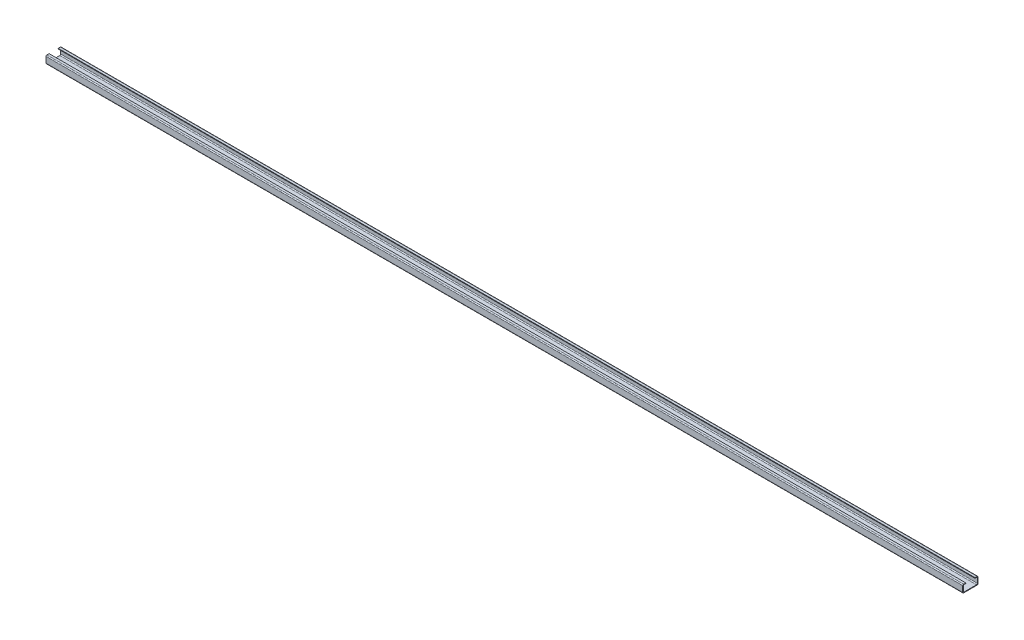
from build123d import *

# Parameters (mm, degrees)
RESSALTO_EXTRUS_O1_DEPTH = 6000
FILETE1_R                = 6


with BuildPart() as part:
    # Esboço1 → Ressalto-extrusão1 (new body)
    with BuildSketch(Plane(origin=(0, 0, 0), x_dir=(0, 0, -1), z_dir=(1, 0, 0))):
        Polygon((-46, 21), (-46, -21), (46, -21), (46, 21), (30, 21), (30, 25), (50, 25), (50, -25), (-50, -25), (-50, 25), (-30, 25), (-30, 21), align=None)
    extrude(amount=RESSALTO_EXTRUS_O1_DEPTH)

    # Filete1
    filete1_edges = [part.edges().sort_by_distance(p)[0] for p in [
        (3000, -25, -50),
        (3000, -25, 50),
        (3000, 25, 50),
        (3000, 21, 46),
        (3000, -21, 46),
        (3000, -21, -46),
        (3000, 21, -46),
        (3000, 25, -50),
    ]]
    fillet(filete1_edges, radius=FILETE1_R)


solid = part.part
